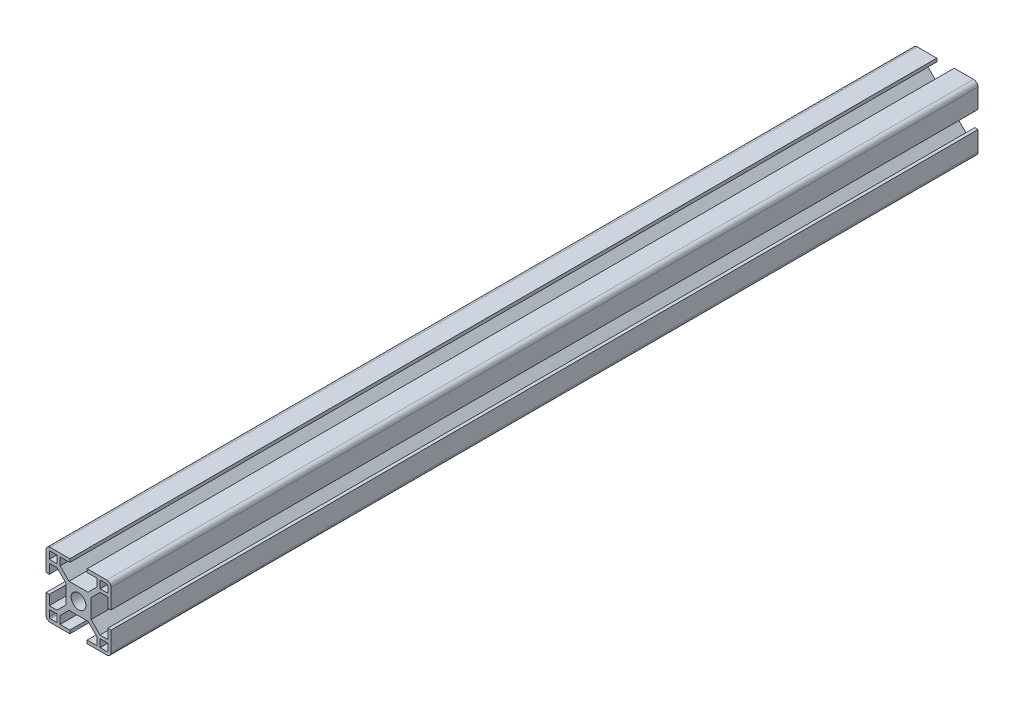
from build123d import *

# Parameters (mm, degrees)
DODANIE_WYCI_GNI_CIE1_DEPTH = 400


with BuildPart() as part:
    # Szkic1 → Dodanie-wyciągnięcie1 (new body)
    with BuildSketch(Plane.XY):
        with BuildLine():
            Line((4.385786438, 5.8), (0, 5.8))
            Line((0, 5.8), (-4.385786438, 5.8))
            Line((-4.385786438, 5.8), (-8.5, 9.914213562))
            Line((-8.5, 9.914213562), (-8.5, 13.5))
            Line((-8.5, 13.5), (-4, 13.5))
            Line((-4, 13.5), (-4, 15))
            Line((-4, 15), (-13, 15))
            ThreePointArc((-13, 15), (-14.414213562, 14.414213562), (-15, 13))
            Line((-15, 13), (-15, 4))
            Line((-15, 4), (-13.5, 4))
            Line((-13.5, 4), (-13.5, 8.5))
            Line((-13.5, 8.5), (-9.914213562, 8.5))
            Line((-9.914213562, 8.5), (-5.8, 4.385786438))
            Line((-5.8, 4.385786438), (-5.8, 0))
            Line((-5.8, 0), (-5.8, -4.385786438))
            Line((-5.8, -4.385786438), (-9.914213562, -8.5))
            Line((-9.914213562, -8.5), (-13.5, -8.5))
            Line((-13.5, -8.5), (-13.5, -4))
            Line((-13.5, -4), (-15, -4))
            Line((-15, -4), (-15, -13))
            ThreePointArc((-15, -13), (-14.414213562, -14.414213562), (-13, -15))
            Line((-13, -15), (-4, -15))
            Line((-4, -15), (-4, -13.5))
            Line((-4, -13.5), (-8.5, -13.5))
            Line((-8.5, -13.5), (-8.5, -9.914213562))
            Line((-8.5, -9.914213562), (-4.385786438, -5.8))
            Line((-4.385786438, -5.8), (0, -5.8))
            Line((0, -5.8), (4.385786438, -5.8))
            Line((4.385786438, -5.8), (8.5, -9.914213562))
            Line((8.5, -9.914213562), (8.5, -13.5))
            Line((8.5, -13.5), (4, -13.5))
            Line((4, -13.5), (4, -15))
            Line((4, -15), (13, -15))
            ThreePointArc((13, -15), (14.414213562, -14.414213562), (15, -13))
            Line((15, -13), (15, -4))
            Line((15, -4), (13.5, -4))
            Line((13.5, -4), (13.5, -8.5))
            Line((13.5, -8.5), (9.914213562, -8.5))
            Line((9.914213562, -8.5), (5.8, -4.385786438))
            Line((5.8, -4.385786438), (5.8, 0))
            Line((5.8, 0), (5.8, 4.385786438))
            Line((5.8, 4.385786438), (9.914213562, 8.5))
            Line((9.914213562, 8.5), (13.5, 8.5))
            Line((13.5, 8.5), (13.5, 4))
            Line((13.5, 4), (15, 4))
            Line((15, 4), (15, 13))
            ThreePointArc((15, 13), (14.414213562, 14.414213562), (13, 15))
            Line((13, 15), (4, 15))
            Line((4, 15), (4, 13.5))
            Line((4, 13.5), (8.5, 13.5))
            Line((8.5, 13.5), (8.5, 9.914213562))
            Line((8.5, 9.914213562), (4.385786438, 5.8))
        make_face()
        with BuildLine():
            Line((-13.5, -10), (-10, -10))
            Line((-10, -10), (-10, -13.5))
            Line((-10, -13.5), (-13, -13.5))
            ThreePointArc((-13, -13.5), (-13.353553391, -13.353553391), (-13.5, -13))
            Line((-13.5, -13), (-13.5, -10))
        make_face(mode=Mode.SUBTRACT)
        with BuildLine():
            Line((10, -13.5), (10, -10))
            Line((10, -10), (13.5, -10))
            Line((13.5, -10), (13.5, -13))
            ThreePointArc((13.5, -13), (13.353553391, -13.353553391), (13, -13.5))
            Line((13, -13.5), (10, -13.5))
        make_face(mode=Mode.SUBTRACT)
        with BuildLine():
            ThreePointArc((3.4, 0), (2.404163056, -2.404163056), (0, -3.4))
            ThreePointArc((0, -3.4), (-2.404163056, -2.404163056), (-3.4, 0))
            ThreePointArc((-3.4, 0), (-2.404163056, 2.404163056), (0, 3.4))
            ThreePointArc((0, 3.4), (2.404163056, 2.404163056), (3.4, 0))
        make_face(mode=Mode.SUBTRACT)
        with BuildLine():
            Line((-10, 13.5), (-10, 10))
            Line((-10, 10), (-13.5, 10))
            Line((-13.5, 10), (-13.5, 13))
            ThreePointArc((-13.5, 13), (-13.353553391, 13.353553391), (-13, 13.5))
            Line((-13, 13.5), (-10, 13.5))
        make_face(mode=Mode.SUBTRACT)
        with BuildLine():
            Line((10, 10), (10, 13.5))
            Line((10, 13.5), (13, 13.5))
            ThreePointArc((13, 13.5), (13.353553391, 13.353553391), (13.5, 13))
            Line((13.5, 13), (13.5, 10))
            Line((13.5, 10), (10, 10))
        make_face(mode=Mode.SUBTRACT)
    extrude(amount=DODANIE_WYCI_GNI_CIE1_DEPTH)


solid = part.part
